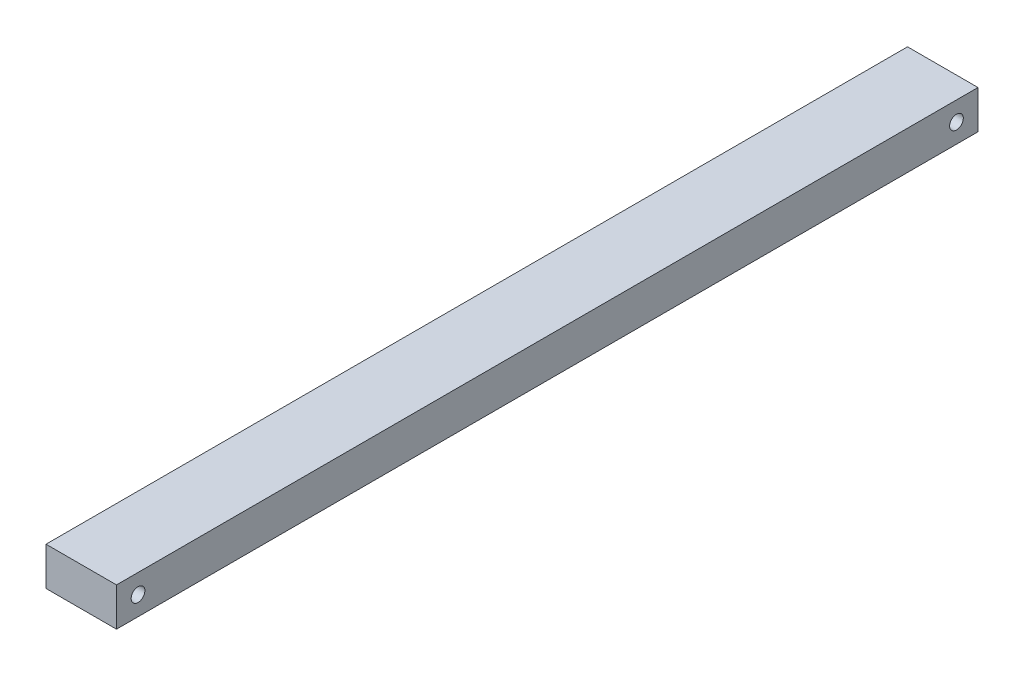
from build123d import *

# Parameters (mm, degrees)
SKETCH1_W           = 18
SKETCH1_H           = 220
BOSS_EXTRUDE1_DEPTH = 9.8
SKETCH3_R           = 1.75
CUT_EXTRUDE1_DEPTH  = 35
SKETCH4_R           = 2.75
CUT_EXTRUDE2_DEPTH  = 4


with BuildPart() as part:
    # Sketch1 → Boss-Extrude1 (new body)
    with BuildSketch(Plane(origin=(0, 0, 0), x_dir=(1, 0, 0), z_dir=(0, 1, 0))):
        Rectangle(SKETCH1_W, SKETCH1_H)
    extrude(amount=BOSS_EXTRUDE1_DEPTH)

    # Sketch3 → Cut-Extrude1 (cut)
    with BuildSketch(Plane.ZY.offset(9)):
        with Locations((-104.5, 4.9)):
            Circle(SKETCH3_R)
        with Locations((104.5, 4.9)):
            Circle(SKETCH3_R)
    extrude(amount=-CUT_EXTRUDE1_DEPTH, mode=Mode.SUBTRACT)

    # Sketch4 → Cut-Extrude2 (cut)
    with BuildSketch(Plane.ZY.offset(9)):
        with Locations((-104.5, 4.9)):
            Circle(SKETCH4_R)
        with Locations((104.5, 4.9)):
            Circle(SKETCH4_R)
    extrude(amount=-CUT_EXTRUDE2_DEPTH, mode=Mode.SUBTRACT)


solid = part.part
